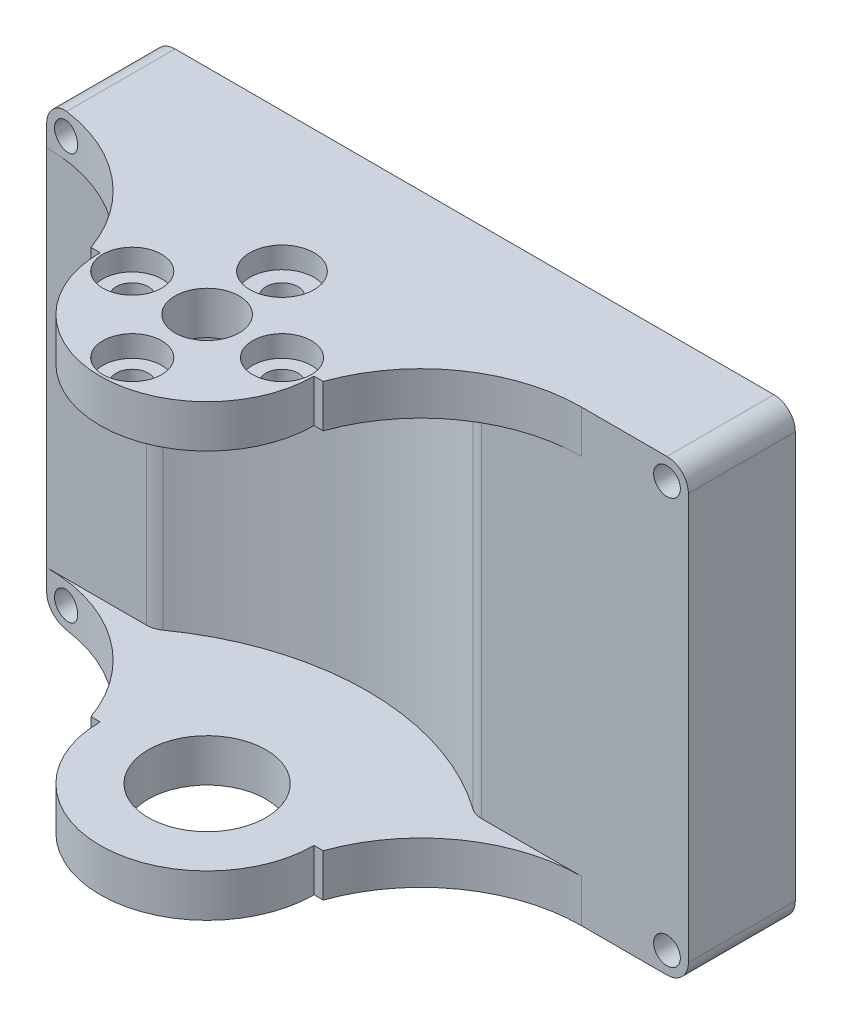
from build123d import *

# Parameters (mm, degrees)
SKETCH_7_W          = 60
SKETCH_7_H          = 42
SKETCH_7_R          = 1.25
EXTRUDE_4_DEPTH     = 10
SKETCH_8_R          = 25
CUT_EXTRUDE_2_DEPTH = 50
SKETCH_9_R          = 5.5
EXTRUDE_5_DEPTH     = 4
CUT_EXTRUDE_4_DEPTH = 4
EXTRUDE_START       = -4
SKETCH_11_R         = 1.5
SKETCH_11_R_2       = 3
EXTRUDE_6_DEPTH     = 4
SKETCH_12_R         = 3
SKETCH_12_R_2       = 2.75
CUT_EXTRUDE_6_DEPTH = 2
SKETCH_15_R         = 1.25
CUT_EXTRUDE_7_DEPTH = 22
FILLET_1_R          = 2
FILLET_2_R          = 2
FILLET_3_R          = 2
FILLET_4_R          = 2
FILLET_6_R          = 2
FILLET_7_R          = 2


with BuildPart() as part:
    # 草图7 → 凸台-拉伸4 (new body)
    with BuildSketch(Plane.XY):
        with Locations((30, 21)):
            Rectangle(SKETCH_7_W, SKETCH_7_H)
        with Locations((2, 40)):
            Circle(SKETCH_7_R, mode=Mode.SUBTRACT)
        with Locations((2, 2)):
            Circle(SKETCH_7_R, mode=Mode.SUBTRACT)
        with Locations((58, 2)):
            Circle(SKETCH_7_R, mode=Mode.SUBTRACT)
        with Locations((58, 40)):
            Circle(SKETCH_7_R, mode=Mode.SUBTRACT)
    extrude(amount=EXTRUDE_4_DEPTH)

    # 草图8 → 切除-拉伸2 (cut)
    with BuildSketch(Plane.XZ):
        with Locations((25, 30)):
            Circle(SKETCH_8_R)
    extrude(amount=-CUT_EXTRUDE_2_DEPTH, mode=Mode.SUBTRACT)

    # 草图9 → 凸台-拉伸5 (add)
    with BuildSketch(Plane.XZ):
        with BuildLine():
            Line((0, 20), (0, 10))
            Line((0, 10), (10, 10))
            ThreePointArc((10, 10), (25, 5), (40, 10))
            Line((40, 10), (50, 10))
            Line((50, 10), (50, 20))
            Line((50, 20), (35, 20))
            ThreePointArc((35, 20), (25, 30), (15, 20))
            Line((15, 20), (0, 20))
        make_face()
        with Locations(Location((25, 20, 0), (0, 0, 270))):
            Circle(SKETCH_9_R, mode=Mode.SUBTRACT)
    extrude(amount=-EXTRUDE_5_DEPTH)

    # 草图10 → 切除-拉伸4 (cut)
    with BuildSketch(Plane.XZ):
        with BuildLine():
            ThreePointArc((0, 10), (8.660254038, 12.752551286), (14.142135624, 20))
            Line((14.142135624, 20), (0, 20))
            Line((0, 20), (0, 10))
        make_face()
        with BuildLine():
            Line((0, 20), (14.142135624, 20))
            ThreePointArc((14.142135624, 20), (14.783978395, 22.463470319), (15, 25))
            ThreePointArc((15, 25), (-10.606601718, 35.606601718), (0, 10))
            Line((0, 10), (0, 20))
        make_face()
        with BuildLine():
            ThreePointArc((65, 25), (47.463470319, 39.783978395), (35.857864376, 20))
            Line((35.857864376, 20), (50, 20))
            Line((50, 20), (50, 10))
            ThreePointArc((50, 10), (60.606601718, 14.393398282), (65, 25))
        make_face()
        with BuildLine():
            Line((50, 20), (35.857864376, 20))
            ThreePointArc((35.857864376, 20), (41.339745962, 12.752551286), (50, 10))
            Line((50, 10), (50, 20))
        make_face()
    extrude(amount=-CUT_EXTRUDE_4_DEPTH, mode=Mode.SUBTRACT)

    # 草图11 → 凸台-拉伸6 (add)
    with BuildSketch(Plane(origin=(0, 42, 0), x_dir=(1, 0, 0), z_dir=(0, 1, 0)).offset(EXTRUDE_START)):
        with BuildLine():
            ThreePointArc((40, -10), (25, -5), (10, -10))
            Line((10, -10), (0, -10))
            ThreePointArc((0, -10), (8.660254038, -12.752551286), (14.142135624, -20))
            Line((14.142135624, -20), (15, -20))
            ThreePointArc((15, -20), (25, -30), (35, -20))
            Line((35, -20), (35.857864376, -20))
            ThreePointArc((35.857864376, -20), (41.339745962, -12.752551286), (50, -10))
            Line((50, -10), (40, -10))
        make_face()
        with Locations(Location((25, -13, 0), (0, 0, 270))):
            Circle(SKETCH_11_R, mode=Mode.SUBTRACT)
        with Locations(Location((18, -20, 0), (0, 0, 270))):
            Circle(SKETCH_11_R, mode=Mode.SUBTRACT)
        with Locations(Location((25, -27, 0), (0, 0, 270))):
            Circle(SKETCH_11_R, mode=Mode.SUBTRACT)
        with Locations(Location((25, -20, 0), (0, 0, 270))):
            Circle(SKETCH_11_R_2, mode=Mode.SUBTRACT)
        with Locations(Location((32, -20, 0), (0, 0, 270))):
            Circle(SKETCH_11_R, mode=Mode.SUBTRACT)
    extrude(amount=EXTRUDE_6_DEPTH)

    # 草图12 → 切除-拉伸6 (cut)
    with BuildSketch(Plane(origin=(0, 42, 0), x_dir=(1, 0, 0), z_dir=(0, 1, 0))):
        with Locations(Location((25, -13, 0), (0, 0, 270))):
            Circle(SKETCH_12_R)
        with Locations(Location((18, -20, 0), (0, 0, 270))):
            Circle(SKETCH_12_R_2)
        with Locations(Location((25, -27, 0), (0, 0, 270))):
            Circle(SKETCH_12_R_2)
        with Locations(Location((32, -20, 0), (0, 0, 270))):
            Circle(SKETCH_12_R_2)
    extrude(amount=-CUT_EXTRUDE_6_DEPTH, mode=Mode.SUBTRACT)

    # 草图15 → 切除-拉伸7 (cut)
    with BuildSketch(Plane(origin=(0, 0, 0), x_dir=(-1, 0, 0), z_dir=(0, 0, -1))):
        with Locations((-2, 2)):
            Circle(SKETCH_15_R)
        with Locations((-2, 40)):
            Circle(SKETCH_15_R)
    extrude(amount=-CUT_EXTRUDE_7_DEPTH, mode=Mode.SUBTRACT)

    # 圆角1
    fillet_1_edges = [part.edges().sort_by_distance(p)[0] for p in [
        (0, 0, 5),
    ]]
    fillet(fillet_1_edges, radius=FILLET_1_R)

    # 圆角2
    fillet_2_edges = [part.edges().sort_by_distance(p)[0] for p in [
        (60, 0, 5),
    ]]
    fillet(fillet_2_edges, radius=FILLET_2_R)

    # 圆角3
    fillet_3_edges = [part.edges().sort_by_distance(p)[0] for p in [
        (60, 42, 5),
    ]]
    fillet(fillet_3_edges, radius=FILLET_3_R)

    # 圆角4
    fillet_4_edges = [part.edges().sort_by_distance(p)[0] for p in [
        (0, 42, 5),
    ]]
    fillet(fillet_4_edges, radius=FILLET_4_R)

    # 圆角6
    fillet_6_edges = [part.edges().sort_by_distance(p)[0] for p in [
        (40, 21, 10),
    ]]
    fillet(fillet_6_edges, radius=FILLET_6_R)

    # 圆角7
    fillet_7_edges = [part.edges().sort_by_distance(p)[0] for p in [
        (10, 21, 10),
    ]]
    fillet(fillet_7_edges, radius=FILLET_7_R)


solid = part.part
